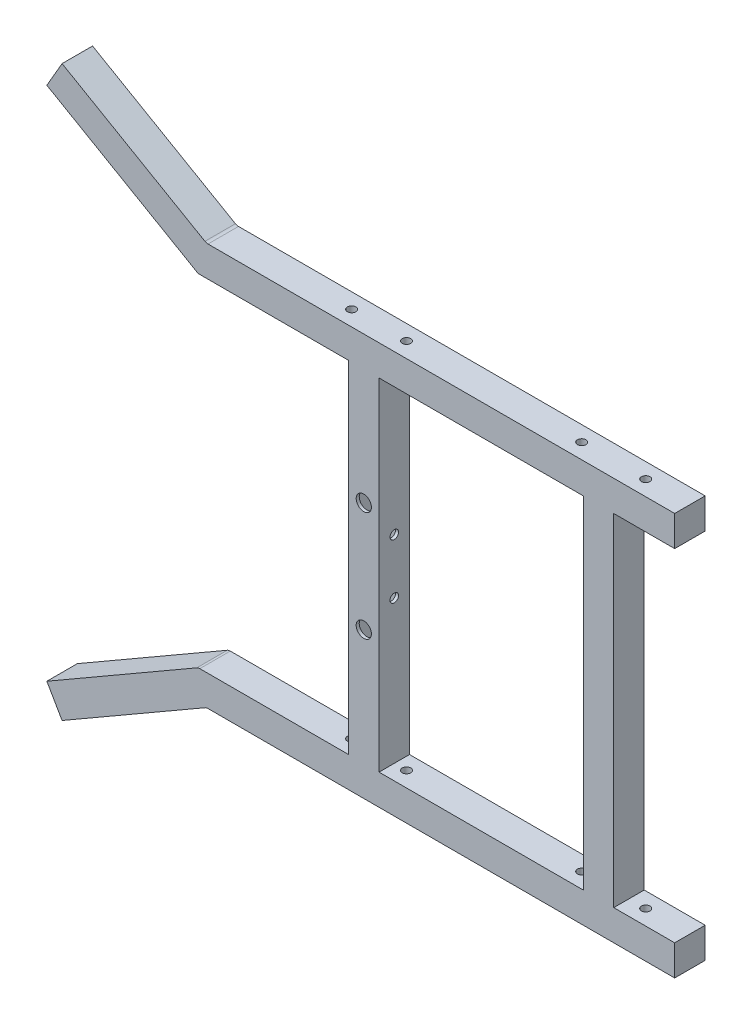
from build123d import *

# Parameters (mm, degrees)
SKETCH1_W               = 385
SKETCH1_H               = 25
SKETCH1_W_2             = 125
BOSS_EXTRUDE4_DEPTH     = 25
FILLET1_R               = 10
FILLET2_R               = 10
SKETCH8_W               = 50
SKETCH8_H               = 50
SKETCH8_W_2             = 40
SKETCH8_H_2             = 40
BOSS_EXTRUDE5_DEPTH     = 280
CUT_EXTRUDE2_DEPTH      = 51
CUT_EXTRUDE2_DEPTH_BACK = 626.028762059
SKETCH11_R              = 7
SKETCH12_R              = 7
CUT_EXTRUDE3_DEPTH      = 1112.711398879
SKETCH13_R              = 12.5
CUT_EXTRUDE4_DEPTH      = 25


with BuildPart() as part:
    # Sketch1 → Boss-Extrude4 (new, symmetric)
    with BuildSketch(Plane.XY):
        Polygon((-254.98711306, -118.349364905), (-242.48711306, -140), (0, 0), (265, 0), (265, 25), (-6.698729811, 25), align=None)
        Polygon((0, 0), (-242.48711306, -140), (-229.98711306, -161.650635095), (6.698729811, -25), (775, -25), (775, 0), (650, 0), (265, 0), align=None)
        with Locations((457.5, 12.5)):
            Rectangle(SKETCH1_W, SKETCH1_H)
        with Locations((712.5, 12.5)):
            Rectangle(SKETCH1_W_2, SKETCH1_H)
    extrude(amount=BOSS_EXTRUDE4_DEPTH, both=True)

    # Fillet1
    fillet1_edges = [part.edges().sort_by_distance(p)[0] for p in [
        (-6.698729811, 25, 0),
    ]]
    fillet(fillet1_edges, radius=FILLET1_R)

    # Fillet2
    fillet2_edges = [part.edges().sort_by_distance(p)[0] for p in [
        (6.698729811, -25, 0),
    ]]
    fillet(fillet2_edges, radius=FILLET2_R)

    # Sketch8 → Boss-Extrude5 (add)
    # profile 1 of 2: a face of its own
    with BuildSketch(Plane(origin=(0, 25, 0), x_dir=(1, 0, 0), z_dir=(0, 1, 0))):
        with Locations((265, 0)):
            Rectangle(SKETCH8_W, SKETCH8_H)
        with Locations((265, 0)):
            Rectangle(SKETCH8_W_2, SKETCH8_H_2, mode=Mode.SUBTRACT)
    # profile 2 of 2: a face of its own
    with BuildSketch(Plane(origin=(0, 25, 0), x_dir=(1, 0, 0), z_dir=(0, 1, 0))):
        with Locations((650.033558731, 0)):
            Rectangle(SKETCH8_W, SKETCH8_H)
        with Locations((650.033558731, 0)):
            Rectangle(SKETCH8_W_2, SKETCH8_H_2, mode=Mode.SUBTRACT)
    extrude(amount=BOSS_EXTRUDE5_DEPTH)

    # Sketch11 → Cut-Extrude2 (cut, two sides: drawn at the far end of the back side and taken through both)
    with BuildSketch(Plane(origin=(290, 0, 0), x_dir=(0, 0, -1), z_dir=(1, 0, 0)).offset(-CUT_EXTRUDE2_DEPTH_BACK)):
        with Locations((0, 260)):
            Circle(SKETCH11_R)
    extrude(amount=CUT_EXTRUDE2_DEPTH + CUT_EXTRUDE2_DEPTH_BACK, mode=Mode.SUBTRACT)

    # Mirror1: part across plane


with BuildPart() as part_1:
    add(part.part)
    add(part.part.mirror(Plane(origin=(0, 305, 0), x_dir=(0, 0, 1), z_dir=(0, -1, 0))))

    # Sketch12 → Cut-Extrude3 (cut, through all)
    with BuildSketch(Plane.XZ.offset(25)):
        with Locations(Location((310, 0, 0), (0, 0, 270))):
            Circle(SKETCH12_R)
        with Locations(Location((220, 0, 0), (0, 0, 270))):
            Circle(SKETCH12_R)
        with Locations(Location((597.5, 0, 0), (0, 0, 270))):
            Circle(SKETCH12_R)
        with Locations(Location((702.5, 0, 0), (0, 0, 270))):
            Circle(SKETCH12_R)
    extrude(amount=-CUT_EXTRUDE3_DEPTH, mode=Mode.SUBTRACT)

    # Sketch13 → Cut-Extrude4 (cut)
    with BuildSketch(Plane.XY.offset(25)):
        with Locations((265, 395)):
            Circle(SKETCH13_R)
        with Locations(Location((265, 215, 0), (0, 0, 180))):
            Circle(SKETCH13_R)
    extrude(amount=-CUT_EXTRUDE4_DEPTH, mode=Mode.SUBTRACT)


solid = part_1.part
